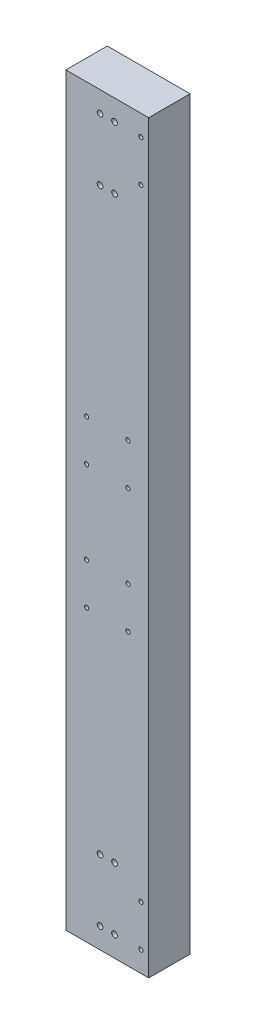
from build123d import *

# Parameters (mm, degrees)
SKETCH1_W           = 101.6
SKETCH1_H           = 50.8
BOSS_EXTRUDE1_DEPTH = 914.4
SKETCH3_R           = 3.4925
CUT_EXTRUDE1_DEPTH  = 50.8
SKETCH4_R           = 2.5527
CUT_EXTRUDE2_DEPTH  = 50.8
SKETCH5_R           = 2.5527
CUT_EXTRUDE3_DEPTH  = 50.8


with BuildPart() as part:
    # Sketch1 → Boss-Extrude1 (new body)
    with BuildSketch(Plane(origin=(0, 0, 0), x_dir=(1, 0, 0), z_dir=(0, 1, 0))):
        Rectangle(SKETCH1_W, SKETCH1_H)
    extrude(amount=BOSS_EXTRUDE1_DEPTH)

    # Sketch3 → Cut-Extrude1 (cut)
    with BuildSketch(Plane(origin=(0, 0, -25.4), x_dir=(-1, 0, 0), z_dir=(0, 0, -1))):
        with Locations((-8.89, 25.4)):
            Circle(SKETCH3_R)
        with Locations((8.89, 25.4)):
            Circle(SKETCH3_R)
        with Locations((8.89, 101.6)):
            Circle(SKETCH3_R)
        with Locations((-8.89, 101.6)):
            Circle(SKETCH3_R)
    cut_extrude1 = extrude(amount=-CUT_EXTRUDE1_DEPTH, mode=Mode.SUBTRACT)

    # Sketch4 → Cut-Extrude2 (cut)
    with BuildSketch(Plane(origin=(0, 0, -25.4), x_dir=(-1, 0, 0), z_dir=(0, 0, -1))):
        with Locations((-41.275, 76.2)):
            Circle(SKETCH4_R)
        with Locations((-41.275, 25.4)):
            Circle(SKETCH4_R)
    cut_extrude2 = extrude(amount=-CUT_EXTRUDE2_DEPTH, mode=Mode.SUBTRACT)

    # Mirror1: Cut-Extrude1, Cut-Extrude2 across plane
    add(cut_extrude1.mirror(Plane.ZX.offset(457.2)), mode=Mode.SUBTRACT)
    add(cut_extrude2.mirror(Plane.ZX.offset(457.2)), mode=Mode.SUBTRACT)

    # Sketch5 → Cut-Extrude3 (cut)
    with BuildSketch(Plane(origin=(0, 0, -25.4), x_dir=(-1, 0, 0), z_dir=(0, 0, -1))):
        with Locations((-25.4, 406.4)):
            Circle(SKETCH5_R)
        with Locations((25.4, 406.4)):
            Circle(SKETCH5_R)
        with Locations((25.4, 355.6)):
            Circle(SKETCH5_R)
        with Locations((-25.4, 355.6)):
            Circle(SKETCH5_R)
    cut_extrude3 = extrude(amount=-CUT_EXTRUDE3_DEPTH, mode=Mode.SUBTRACT)

    # Mirror2: Cut-Extrude3 across plane
    add(cut_extrude3.mirror(Plane.ZX.offset(457.2)), mode=Mode.SUBTRACT)


solid = part.part
